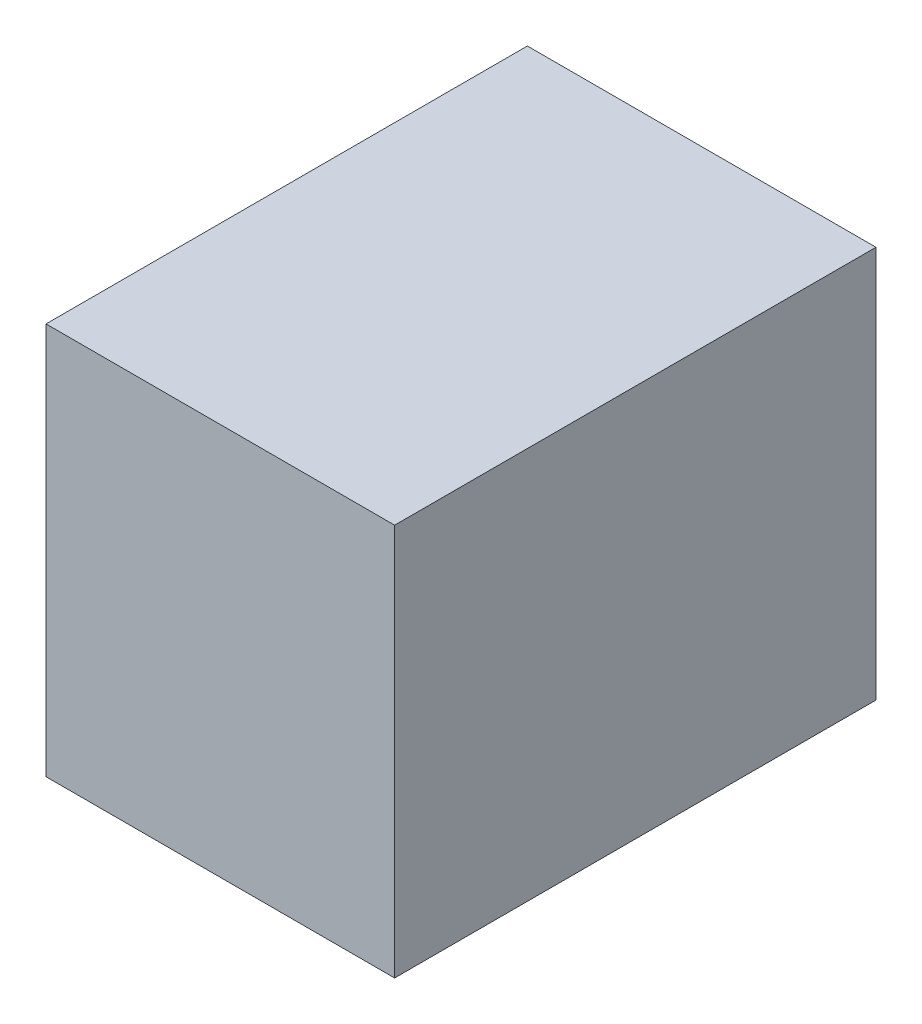
from build123d import *

# Parameters (mm, degrees)
SKETCH1_W                   = 55.233155238
SKETCH1_H                   = 45
BOSS_EXTRUDE1_DEPTH         = 40
M10X1_25_TAPPED_HOLE1_D     = 8.8
M10X1_25_TAPPED_HOLE1_DEPTH = 11.75
M10X1_25_TAPPED_HOLE1_TIP   = 2.643786724


with BuildPart() as part:
    # Sketch1 → Boss-Extrude1 (new body)
    with BuildSketch(Plane(origin=(-82.778181514, 0, 0), x_dir=(0, 0, -1), z_dir=(1, 0, 0))):
        with Locations((-566.428701217, 22.5)):
            Rectangle(SKETCH1_W, SKETCH1_H)
    extrude(amount=BOSS_EXTRUDE1_DEPTH)

    # M10x1.25 Tapped Hole1
    with Locations(Plane.ZY.offset(82.778181514)):
        with Locations((583.767961031, 20.315155656), (558.767961031, 20.315155656)):
            Hole(M10X1_25_TAPPED_HOLE1_D / 2, depth=M10X1_25_TAPPED_HOLE1_DEPTH)
            with Locations((0, 0, -(M10X1_25_TAPPED_HOLE1_DEPTH + M10X1_25_TAPPED_HOLE1_TIP / 2))):  # 118° drill point
                Cone(0, M10X1_25_TAPPED_HOLE1_D / 2, M10X1_25_TAPPED_HOLE1_TIP, mode=Mode.SUBTRACT)


solid = part.part
